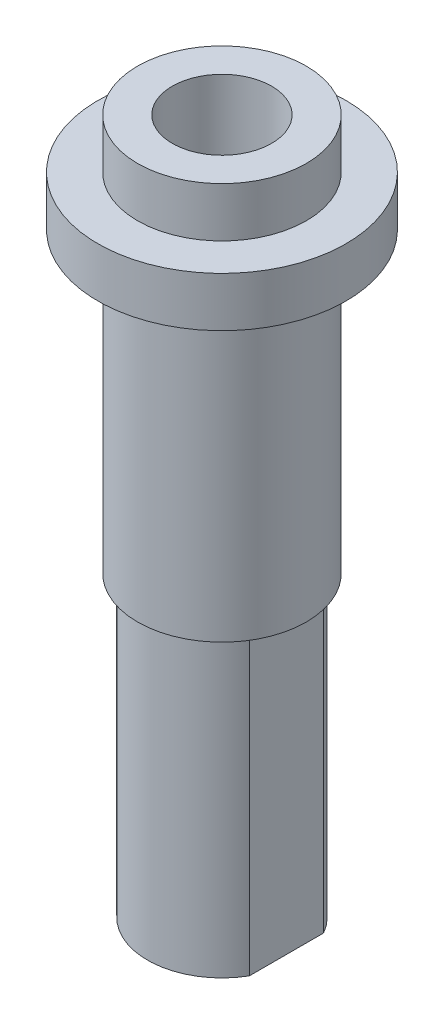
from build123d import *

# Parameters (mm, degrees)
SKETCH_2_OUTSIDE_W  = 42.684
SKETCH_2_OUTSIDE_H  = 42.684
CUT_EXTRUDE_1_DEPTH = 30


with BuildPart() as part:
    # Эскиз1 → Повернуть1 (revolve)
    with BuildSketch(Plane.XY, mode=Mode.PRIVATE) as revolve_1_sk:
        Polygon((5, 70), (5, 0), (8.5, 0), (8.5, 60), (12.5, 60), (12.5, 65), (8.5, 65), (8.5, 70), align=None)
    revolve(revolve_1_sk.sketch.rotate(Axis((0, 0, 0), (0, 1, 0)), 90), axis=Axis((0, 0, 0), (0, 1, 0)))

    # Эскиз2 outside → Вырез-Вытянуть1 (cut)
    with BuildSketch(Plane.XZ):
        Rectangle(SKETCH_2_OUTSIDE_W, SKETCH_2_OUTSIDE_H)
        with BuildLine():
            Line((6.5, 3.741657387), (6.5, -3.741657387))
            ThreePointArc((6.5, -3.741657387), (-7.5, 0), (6.5, 3.741657387))
        make_face(mode=Mode.SUBTRACT)
    extrude(amount=-CUT_EXTRUDE_1_DEPTH, mode=Mode.SUBTRACT)


solid = part.part
